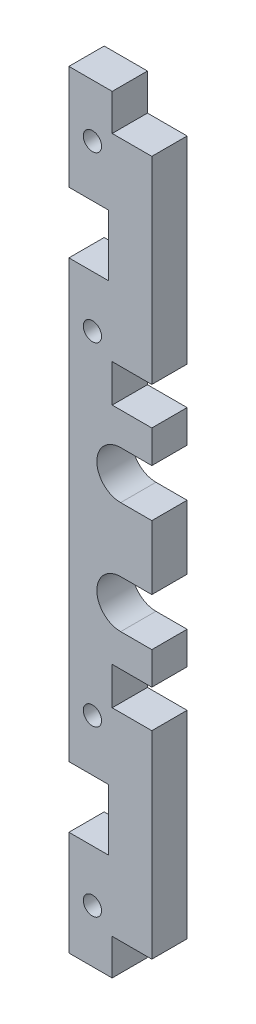
from build123d import *

# Parameters (mm, degrees)
SZKIC1_W                    = 14.1
SZKIC1_H                    = 136.58
DODANIE_WYCI_GNI_CIE1_DEPTH = 6
PRZENIE_CIAN_1_BY           = 6
SZKIC3_W                    = 6.75
SZKIC3_H                    = 10.4
SZKIC3_W_2                  = 6.95
SZKIC3_H_2                  = 6.4
SZKIC3_H_3                  = 6.342942851
WYTNIJ_WYCI_GNI_CIE1_DEPTH  = 107.058352026
SZKIC4_R                    = 1.55
WYTNIJ_WYCI_GNI_CIE2_DEPTH  = 107.058352026
WYTNIJ_WYCI_GNI_CIE3_DEPTH  = 10


with BuildPart() as part:
    # Szkic1 → Dodanie-wyciągnięcie1 (new body)
    with BuildSketch(Plane.XY):
        with Locations((-72.400450183, 1.710000001)):
            Rectangle(SZKIC1_W, SZKIC1_H)
    extrude(amount=-DODANIE_WYCI_GNI_CIE1_DEPTH)

    # Przenieś ścianę1: a face moved inward by 6.0
    extrude(part.faces().sort_by_distance((-72.400450183, -66.579999999, -3))[0], amount=PRZENIE_CIAN_1_BY, dir=(0, 1, 0), mode=Mode.SUBTRACT)

    # Szkic3 → Wytnij-wyciągnięcie1 (cut, through all)
    with BuildSketch(Plane.XY):
        with Locations((-76.075450183, -37.590311709)):
            Rectangle(SZKIC3_W, SZKIC3_H)
        with Locations((-68.613894602, 67.000000001)):
            Rectangle(SZKIC3_W_2, SZKIC3_H_2)
        with Locations((-68.613894602, 27.000000001)):
            Rectangle(SZKIC3_W_2, SZKIC3_H_2)
        with Locations((-68.625450183, -57.608528574)):
            Rectangle(SZKIC3_W_2, SZKIC3_H_3)
        with Locations((-68.613894602, -17.579999999)):
            Rectangle(SZKIC3_W_2, SZKIC3_H_2)
        with Locations((-76.075450183, 47.000000001)):
            Rectangle(SZKIC3_W, SZKIC3_H)
    extrude(amount=-WYTNIJ_WYCI_GNI_CIE1_DEPTH, mode=Mode.SUBTRACT)

    # Szkic4 → Wytnij-wyciągnięcie2 (cut, through all)
    with BuildSketch(Plane.XY):
        with Locations((-75.450450183, 61.000000001)):
            Circle(SZKIC4_R)
        with Locations((-75.450450183, -51.579999999)):
            Circle(SZKIC4_R)
        with Locations((-75.450450183, 33.000000001)):
            Circle(SZKIC4_R)
        with Locations((-75.450450183, -23.579999999)):
            Circle(SZKIC4_R)
    extrude(amount=-WYTNIJ_WYCI_GNI_CIE2_DEPTH, mode=Mode.SUBTRACT)

    # Szkic5 → Wytnij-wyciągnięcie3 (cut)
    with BuildSketch(Plane(origin=(0, 0, -6), x_dir=(-1, 0, 0), z_dir=(0, 0, -1))):
        with BuildLine():
            Line((65.350450183, -0.745155849), (65.350450183, -8.845155849))
            Line((65.350450183, -8.845155849), (70.650450183, -8.845155849))
            ThreePointArc((70.650450183, -8.845155849), (74.700450183, -4.795155849), (70.650450183, -0.745155849))
            Line((70.650450183, -0.745155849), (65.350450183, -0.745155849))
        make_face()
        with BuildLine():
            Line((65.350450183, 10.154844151), (70.650450183, 10.154844151))
            ThreePointArc((70.650450183, 10.154844151), (74.700450183, 14.204844151), (70.650450183, 18.254844151))
            Line((70.650450183, 18.254844151), (65.350450183, 18.254844151))
            Line((65.350450183, 18.254844151), (65.350450183, 10.154844151))
        make_face()
    extrude(amount=-WYTNIJ_WYCI_GNI_CIE3_DEPTH, mode=Mode.SUBTRACT)


solid = part.part
